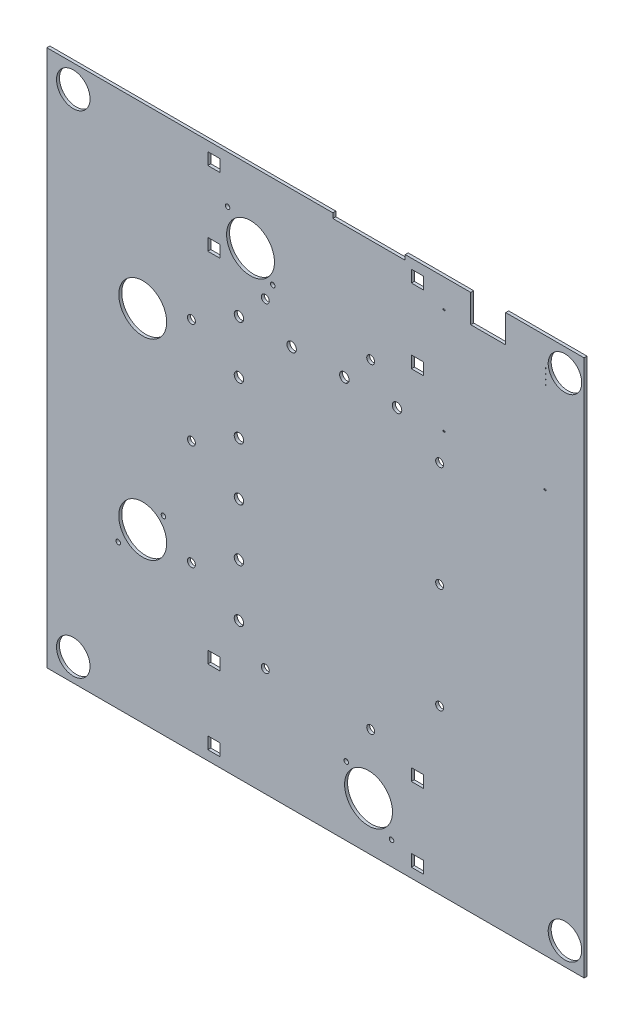
from build123d import *

# Parameters (mm, degrees)
SKETCH3_W           = 1.142982335
SKETCH3_H           = 0.634990186
SKETCH3_R           = 8.889862612
SKETCH3_W_2         = 6.35
SKETCH3_H_2         = 6.35
SKETCH3_R_2         = 2.1
SKETCH3_R_3         = 1.1994003
SKETCH3_R_4         = 12.7
SKETCH3_W_3         = 15.29976355
SKETCH3_H_3         = 7.434865471
SKETCH3_R_5         = 0.229996446
SKETCH3_W_4         = 0.888986261
SKETCH3_W_5         = 15.299763551
SKETCH3_H_4         = 0.634990187
BOSS_EXTRUDE1_DEPTH = 1.5748


with BuildPart() as part:
    # Sketch3 → Boss-Extrude1 (new body)
    # profile 1 of 16: a face of its own
    with BuildSketch(Plane.XY):
        with BuildLine():
            Line((-133.885450353, -29.177459631), (-133.885450353, -14.33744427))
            Line((-133.885450353, -14.33744427), (-148.619709887, -14.33744427))
            ThreePointArc((-148.619709887, -14.33744427), (-148.713001643, -14.959958142), (-148.744201092, -15.588650011))
            Line((-148.744201092, -15.588650011), (-148.744201092, -82.897609788))
            ThreePointArc((-148.744201092, -82.897609788), (-148.703232163, -83.916882208), (-148.580589702, -84.929578385))
            Line((-148.580589702, -84.929578385), (-147.474220719, -84.929578385))
            Line((-147.474220719, -84.929578385), (-147.474220719, -85.564568572))
            Line((-147.474220719, -85.564568572), (-148.461013069, -85.564568572))
            ThreePointArc((-148.461013069, -85.564568572), (-144.02610024, -92.77573886), (-136.04439736, -95.597413519))
            Line((-136.04439736, -95.597413519), (-106.834848778, -95.597413519))
            ThreePointArc((-106.834848778, -95.597413519), (-98.853145899, -92.77573886), (-94.418233069, -85.564568572))
            Line((-94.418233069, -85.564568572), (-95.024031308, -85.564568572))
            Line((-95.024031308, -85.564568572), (-95.024031308, -84.929578385))
            Line((-95.024031308, -84.929578385), (-94.298656436, -84.929578385))
            ThreePointArc((-94.298656436, -84.929578385), (-94.176013976, -83.916882208), (-94.135045047, -82.897609788))
            Line((-94.135045047, -82.897609788), (-94.135045047, -37.305314392))
            Line((-94.135045047, -37.305314392), (-95.024031308, -37.305314392))
            Line((-95.024031308, -37.305314392), (-95.024031308, -36.670324206))
            Line((-95.024031308, -36.670324206), (-94.135045047, -36.670324206))
            Line((-94.135045047, -36.670324206), (-94.135045047, -34.765353646))
            Line((-94.135045047, -34.765353646), (-95.024031308, -34.765353646))
            Line((-95.024031308, -34.765353646), (-95.024031308, -34.130363459))
            Line((-95.024031308, -34.130363459), (-94.135045047, -34.130363459))
            Line((-94.135045047, -34.130363459), (-94.135045047, -32.2253929))
            Line((-94.135045047, -32.2253929), (-95.024031308, -32.2253929))
            Line((-95.024031308, -32.2253929), (-95.024031308, -31.590402713))
            Line((-95.024031308, -31.590402713), (-94.135045047, -31.590402713))
            Line((-94.135045047, -31.590402713), (-94.135045047, -29.685432153))
            Line((-94.135045047, -29.685432153), (-95.024031308, -29.685432153))
            Line((-95.024031308, -29.685432153), (-95.024031308, -29.050441967))
            Line((-95.024031308, -29.050441967), (-94.135045047, -29.050441967))
            Line((-94.135045047, -29.050441967), (-94.135045047, -15.588650011))
            ThreePointArc((-94.135045047, -15.588650011), (-94.166244495, -14.959958142), (-94.259536251, -14.33744427))
            Line((-94.259536251, -14.33744427), (-115.343697651, -14.33744427))
            Line((-115.343697651, -14.33744427), (-115.343697651, -29.177459631))
            Line((-115.343697651, -29.177459631), (-133.885450353, -29.177459631))
        make_face()
        with Locations((-148.045711887, -29.36793706)):
            Rectangle(SKETCH3_W, SKETCH3_H, mode=Mode.SUBTRACT)
    # profile 2 of 16: a face of its own
    with BuildSketch(Plane.XY):
        with BuildLine():
            ThreePointArc((-148.744201092, -15.588650011), (-148.713001643, -14.959958142), (-148.619709887, -14.33744427))
            Line((-148.619709887, -14.33744427), (-168.623873299, -14.33744427))
            Line((-168.623873299, -14.33744427), (-168.623873299, -16.963648389))
            Line((-168.623873299, -16.963648389), (-169.893873299, -16.963648389))
            Line((-169.893873299, -16.963648389), (-169.893873299, -24.39851386))
            Line((-169.893873299, -24.39851386), (-185.193636849, -24.39851386))
            Line((-185.193636849, -24.39851386), (-185.193636849, -16.963648389))
            Line((-185.193636849, -16.963648389), (-190.419987148, -16.963648389))
            Line((-190.419987148, -16.963648389), (-190.419987148, -24.39851386))
            Line((-190.419987148, -24.39851386), (-205.719750699, -24.39851386))
            Line((-205.719750699, -24.39851386), (-205.719750699, -16.963648389))
            Line((-205.719750699, -16.963648389), (-206.989750699, -16.963648389))
            Line((-206.989750699, -16.963648389), (-206.989750699, -14.33744427))
            Line((-206.989750699, -14.33744427), (-358.611033577, -14.33744427))
            Line((-358.611033577, -14.33744427), (-358.611033577, -299.127526398))
            Line((-358.611033577, -299.127526398), (-73.782321777, -299.127526398))
            Line((-73.782321777, -299.127526398), (-73.782321777, -14.33744427))
            Line((-73.782321777, -14.33744427), (-94.259536251, -14.33744427))
            ThreePointArc((-94.259536251, -14.33744427), (-94.166244495, -14.959958142), (-94.135045047, -15.588650011))
            Line((-94.135045047, -15.588650011), (-94.135045047, -29.050441967))
            Line((-94.135045047, -29.050441967), (-93.881048972, -29.050441967))
            Line((-93.881048972, -29.050441967), (-93.881048972, -29.685432153))
            Line((-93.881048972, -29.685432153), (-94.135045047, -29.685432153))
            Line((-94.135045047, -29.685432153), (-94.135045047, -31.590402713))
            Line((-94.135045047, -31.590402713), (-93.881048972, -31.590402713))
            Line((-93.881048972, -31.590402713), (-93.881048972, -32.2253929))
            Line((-93.881048972, -32.2253929), (-94.135045047, -32.2253929))
            Line((-94.135045047, -32.2253929), (-94.135045047, -34.130363459))
            Line((-94.135045047, -34.130363459), (-93.881048972, -34.130363459))
            Line((-93.881048972, -34.130363459), (-93.881048972, -34.765353646))
            Line((-93.881048972, -34.765353646), (-94.135045047, -34.765353646))
            Line((-94.135045047, -34.765353646), (-94.135045047, -36.670324206))
            Line((-94.135045047, -36.670324206), (-93.881048972, -36.670324206))
            Line((-93.881048972, -36.670324206), (-93.881048972, -37.305314392))
            Line((-93.881048972, -37.305314392), (-94.135045047, -37.305314392))
            Line((-94.135045047, -37.305314392), (-94.135045047, -82.897609788))
            ThreePointArc((-94.135045047, -82.897609788), (-94.176013976, -83.916882208), (-94.298656436, -84.929578385))
            Line((-94.298656436, -84.929578385), (-93.881048972, -84.929578385))
            Line((-93.881048972, -84.929578385), (-93.881048972, -85.564568572))
            Line((-93.881048972, -85.564568572), (-94.418233069, -85.564568572))
            ThreePointArc((-94.418233069, -85.564568572), (-98.853145899, -92.77573886), (-106.834848778, -95.597413519))
            Line((-106.834848778, -95.597413519), (-136.04439736, -95.597413519))
            ThreePointArc((-136.04439736, -95.597413519), (-144.02610024, -92.77573886), (-148.461013069, -85.564568572))
            Line((-148.461013069, -85.564568572), (-148.617203054, -85.564568572))
            Line((-148.617203054, -85.564568572), (-148.617203054, -84.929578385))
            Line((-148.617203054, -84.929578385), (-148.580589702, -84.929578385))
            ThreePointArc((-148.580589702, -84.929578385), (-148.703232163, -83.916882208), (-148.744201092, -82.897609788))
            Line((-148.744201092, -82.897609788), (-148.744201092, -15.588650011))
        make_face()
        with Locations((-344.639103912, -287.023912366)):
            Circle(SKETCH3_R, mode=Mode.SUBTRACT)
        with Locations((-270.124321777, -290.872526398)):
            Rectangle(SKETCH3_W_2, SKETCH3_H_2, mode=Mode.SUBTRACT)
        with Locations((-270.124321777, -251.502526398)):
            Rectangle(SKETCH3_W_2, SKETCH3_H_2, mode=Mode.SUBTRACT)
        with BuildLine():
            add(Edge.make_bspline(
                [(-256.85999724, -224.021638864), (-257.021406013, -224.024309852), (-257.382414589, -224.074215165), (-257.916655919, -224.260511889), (-258.393325401, -224.57565247), (-258.766949849, -224.95828446), (-259.037170306, -225.381045042), (-259.221024648, -225.847743239), (-259.306051527, -226.342510426), (-259.294349108, -226.844398246), (-259.180495231, -227.333693057), (-258.974693819, -227.791790332), (-258.679822326, -228.198319036), (-258.312526177, -228.540315274), (-257.883336296, -228.800297414), (-257.412415908, -228.972873885), (-256.91538887, -229.046087349), (-256.412950397, -229.022203622), (-255.925717826, -228.895990433), (-255.472661348, -228.678654156), (-255.073828625, -228.37389952), (-254.741211158, -227.998393935), (-254.491989175, -227.562985092), (-254.331137625, -227.087999747), (-254.270318799, -226.589969862), (-254.306336953, -226.08964653), (-254.443616789, -225.606722239), (-254.671216109, -225.1592348), (-254.985454685, -224.767232517), (-255.369144621, -224.443332536), (-255.810102944, -224.204036936), (-256.20100592, -224.083682076), (-256.509196877, -224.033782598), (-256.699570041, -224.022858517), (-256.815641836, -224.020904872), (-256.85999724, -224.021638864)],
                knots=[0, 0, 0, 0, 0.030814505, 0.069019597, 0.107055287, 0.13877011, 0.17045323, 0.202182021, 0.233877764, 0.265639407, 0.297365916, 0.329128555, 0.360857163, 0.392586882, 0.424283508, 0.45600014, 0.487681866, 0.519541267, 0.551365692, 0.583108167, 0.614814611, 0.646536051, 0.678220231, 0.709938745, 0.741618915, 0.773352224, 0.805046826, 0.836812076, 0.868540761, 0.900300889, 0.93202604, 0.963646014, 0.977849544, 0.991532122, 1, 1, 1, 1], degree=3))
        make_face(mode=Mode.SUBTRACT)
        with Locations((-242.821182519, -241.57744427)):
            Circle(SKETCH3_R_2, mode=Mode.SUBTRACT)
        with Locations((-320.804539148, -222.421426972)):
            Circle(SKETCH3_R_3, mode=Mode.SUBTRACT)
        with Locations((-307.811033577, -210.227526398)):
            Circle(SKETCH3_R_4, mode=Mode.SUBTRACT)
        with Locations((-296.816528582, -198.431137058)):
            Circle(SKETCH3_R_3, mode=Mode.SUBTRACT)
        with Locations((-282.001182519, -212.55744427)):
            Circle(SKETCH3_R_2, mode=Mode.SUBTRACT)
        with BuildLine():
            add(Edge.make_bspline(
                [(-256.85999724, -196.081638864), (-257.021406013, -196.084309852), (-257.382414589, -196.134215165), (-257.916655919, -196.320511889), (-258.393325401, -196.63565247), (-258.766949849, -197.01828446), (-259.037170306, -197.441045042), (-259.221024648, -197.907743239), (-259.306051527, -198.402510426), (-259.294349108, -198.904398246), (-259.180495231, -199.393693057), (-258.974693819, -199.851790332), (-258.679822326, -200.258319036), (-258.312526177, -200.600315274), (-257.883336296, -200.860297414), (-257.412415908, -201.032873885), (-256.91538887, -201.106087349), (-256.412950397, -201.082203622), (-255.925717826, -200.955990433), (-255.472661348, -200.738654156), (-255.073828625, -200.43389952), (-254.741211158, -200.058393935), (-254.491989175, -199.622985092), (-254.331137625, -199.147999747), (-254.270318799, -198.649969862), (-254.306336953, -198.14964653), (-254.443616789, -197.666722239), (-254.671216109, -197.2192348), (-254.985454685, -196.827232517), (-255.369144621, -196.503332536), (-255.810102944, -196.264036936), (-256.20100592, -196.143682076), (-256.509196877, -196.093782598), (-256.699570041, -196.082858517), (-256.815641836, -196.080904872), (-256.85999724, -196.081638864)],
                knots=[0, 0, 0, 0, 0.030814505, 0.069019597, 0.107055287, 0.13877011, 0.17045323, 0.202182021, 0.233877764, 0.265639407, 0.297365916, 0.329128555, 0.360857163, 0.392586882, 0.424283508, 0.45600014, 0.487681866, 0.519541267, 0.551365692, 0.583108167, 0.614814611, 0.646536051, 0.678220231, 0.709938745, 0.741618915, 0.773352224, 0.805046826, 0.836812076, 0.868540761, 0.900300889, 0.93202604, 0.963646014, 0.977849544, 0.991532122, 1, 1, 1, 1], degree=3))
        make_face(mode=Mode.SUBTRACT)
        with Locations((-282.001182519, -156.67744427)):
            Circle(SKETCH3_R_2, mode=Mode.SUBTRACT)
        with BuildLine():
            add(Edge.make_bspline(
                [(-256.85999724, -168.141638864), (-257.021406013, -168.144309852), (-257.382414589, -168.194215165), (-257.916655919, -168.380511889), (-258.393325401, -168.69565247), (-258.766949849, -169.07828446), (-259.037170306, -169.501045042), (-259.221024648, -169.967743239), (-259.306051527, -170.462510426), (-259.294349108, -170.964398246), (-259.180495231, -171.453693057), (-258.974693819, -171.911790332), (-258.679822326, -172.318319036), (-258.312526177, -172.660315274), (-257.883336296, -172.920297414), (-257.412415907, -173.092873888), (-256.915388874, -173.166087339), (-256.412950373, -173.14220366), (-255.925717286, -173.015990136), (-255.472660508, -172.798654333), (-255.073827799, -172.493897777), (-254.741211427, -172.118392321), (-254.491988527, -171.682984122), (-254.331137697, -171.207999706), (-254.27031878, -170.709969873), (-254.306336958, -170.209646527), (-254.443616788, -169.726722239), (-254.671216109, -169.2792348), (-254.985454686, -168.887232516), (-255.369144622, -168.563332534), (-255.810102946, -168.324036936), (-256.201005919, -168.203682076), (-256.509196877, -168.153782598), (-256.699570041, -168.142858517), (-256.815641836, -168.140904872), (-256.85999724, -168.141638864)],
                knots=[0, 0, 0, 0, 0.030814505, 0.069019599, 0.107055288, 0.138770112, 0.170453233, 0.202182024, 0.233877768, 0.265639411, 0.29736592, 0.32912856, 0.360857169, 0.392586888, 0.424283514, 0.456000147, 0.487681873, 0.519541275, 0.5513657, 0.583108297, 0.614814617, 0.646536271, 0.678220227, 0.709938741, 0.741618911, 0.773352221, 0.805046823, 0.836812073, 0.868540759, 0.900300887, 0.932026039, 0.963646013, 0.977849544, 0.991532122, 1, 1, 1, 1], degree=3))
        make_face(mode=Mode.SUBTRACT)
        with Locations((-199.878713211, -262.73302365)):
            Circle(SKETCH3_R_3, mode=Mode.SUBTRACT)
        with Locations((-188.082321777, -273.727526398)):
            Circle(SKETCH3_R_4, mode=Mode.SUBTRACT)
        with Locations((-175.888418729, -286.721029647)):
            Circle(SKETCH3_R_3, mode=Mode.SUBTRACT)
        with Locations((-162.174321777, -290.872526398)):
            Rectangle(SKETCH3_W_2, SKETCH3_H_2, mode=Mode.SUBTRACT)
        with Locations((-186.941182519, -241.57744427)):
            Circle(SKETCH3_R_2, mode=Mode.SUBTRACT)
        with Locations((-162.174321777, -251.502526398)):
            Rectangle(SKETCH3_W_2, SKETCH3_H_2, mode=Mode.SUBTRACT)
        with Locations((-83.917293159, -287.023912366)):
            Circle(SKETCH3_R, mode=Mode.SUBTRACT)
        with Locations((-150.399321777, -212.55744427)):
            Circle(SKETCH3_R_2, mode=Mode.SUBTRACT)
        with BuildLine():
            ThreePointArc((-151.618840591, -154.967832073), (-149.437809819, -154.810496291), (-148.299321777, -156.67744427))
            ThreePointArc((-148.299321777, -156.67744427), (-151.360833735, -158.544392248), (-151.618840591, -154.967832073))
        make_face(mode=Mode.SUBTRACT)
        with Locations((-307.811033577, -108.627526398)):
            Circle(SKETCH3_R_4, mode=Mode.SUBTRACT)
        with BuildLine():
            add(Edge.make_bspline(
                [(-256.85999724, -140.201638864), (-257.021406165, -140.204309847), (-257.382415009, -140.254215108), (-257.916656107, -140.440512414), (-258.393325613, -140.755652577), (-258.766949839, -141.138284477), (-259.037170308, -141.561045037), (-259.22102465, -142.027743242), (-259.306051516, -142.52251042), (-259.294349148, -143.024398267), (-259.18049493, -143.513693632), (-258.974694037, -143.971791212), (-258.679821182, -144.378320018), (-258.312525009, -144.720315059), (-257.883336553, -144.980297614), (-257.412416575, -145.152872668), (-256.91539018, -145.226086503), (-256.412950715, -145.20220401), (-255.925718176, -145.075990507), (-255.472661345, -144.85865418), (-255.073828626, -144.553899514), (-254.741211157, -144.178393936), (-254.491989175, -143.742985092), (-254.331137625, -143.267999747), (-254.270318799, -142.769969862), (-254.306336953, -142.26964653), (-254.443616789, -141.786722239), (-254.671216109, -141.3392348), (-254.985454685, -140.947232517), (-255.369144621, -140.623332536), (-255.810102944, -140.384036936), (-256.20100592, -140.263682076), (-256.509196877, -140.213782599), (-256.699570042, -140.202858515), (-256.815641836, -140.200904874), (-256.85999724, -140.201638864)],
                knots=[0, 0, 0, 0, 0.030814534, 0.069019644, 0.107055287, 0.138770111, 0.170453232, 0.202182023, 0.233877767, 0.265639411, 0.29736592, 0.329128687, 0.360857171, 0.392587044, 0.424283511, 0.455999957, 0.487681857, 0.519541184, 0.551365681, 0.583108157, 0.614814601, 0.646536043, 0.678220224, 0.709938738, 0.741618909, 0.773352218, 0.805046821, 0.836812072, 0.868540758, 0.900300886, 0.932026039, 0.963646013, 0.977849544, 0.991532122, 1, 1, 1, 1], degree=3))
        make_face(mode=Mode.SUBTRACT)
        with Locations((-282.001182519, -100.79744427)):
            Circle(SKETCH3_R_2, mode=Mode.SUBTRACT)
        with BuildLine():
            add(Edge.make_bspline(
                [(-256.85999724, -112.261638864), (-257.021406013, -112.264309852), (-257.382414589, -112.314215165), (-257.916655919, -112.500511889), (-258.393325401, -112.81565247), (-258.766949849, -113.19828446), (-259.037170306, -113.621045042), (-259.221024648, -114.087743239), (-259.306051527, -114.582510426), (-259.294349108, -115.084398246), (-259.180495232, -115.573693059), (-258.974693815, -116.031790325), (-258.679822368, -116.438319024), (-258.312526163, -116.780315146), (-257.883337234, -117.040297063), (-257.412416597, -117.212872714), (-256.915390174, -117.286086475), (-256.412950684, -117.262204075), (-255.925717281, -117.135990012), (-255.472659952, -116.918654478), (-255.073827277, -116.613897745), (-254.741211725, -116.238392122), (-254.491988674, -115.802984185), (-254.331137623, -115.327999811), (-254.270318791, -114.829969958), (-254.306336977, -114.329646533), (-254.443616757, -113.846722296), (-254.671216111, -113.39923488), (-254.985454601, -113.007232606), (-255.369144544, -112.68333252), (-255.810102899, -112.444036966), (-256.201005919, -112.323682075), (-256.509196878, -112.273782599), (-256.699570041, -112.262858517), (-256.815641836, -112.260904872), (-256.85999724, -112.261638864)],
                knots=[0, 0, 0, 0, 0.030814506, 0.0690196, 0.10705529, 0.138770114, 0.170453236, 0.202182027, 0.233877771, 0.265639415, 0.297365925, 0.329128565, 0.360857174, 0.392586885, 0.424283519, 0.455999966, 0.487681866, 0.519541192, 0.55136569, 0.583108366, 0.614814614, 0.646536265, 0.678220222, 0.709938719, 0.741618907, 0.773352217, 0.80504682, 0.836812058, 0.868540757, 0.900300875, 0.932026038, 0.963646013, 0.977849544, 0.991532122, 1, 1, 1, 1], degree=3))
        make_face(mode=Mode.SUBTRACT)
        with BuildLine():
            add(Edge.make_bspline(
                [(-256.85999724, -84.321638864), (-257.021406013, -84.324309852), (-257.382414591, -84.374215163), (-257.916655909, -84.560511898), (-258.39332531, -84.875652355), (-258.766949645, -85.258284434), (-259.037170146, -85.681044833), (-259.221024721, -86.147743103), (-259.306051502, -86.642510319), (-259.294349116, -87.144398244), (-259.180495229, -87.633693058), (-258.97469382, -88.091790332), (-258.679822326, -88.498319036), (-258.312526177, -88.840315274), (-257.883336296, -89.100297414), (-257.412415908, -89.272873885), (-256.91538887, -89.346087349), (-256.412950397, -89.322203622), (-255.925717826, -89.195990433), (-255.472661348, -88.978654156), (-255.073828625, -88.67389952), (-254.741211158, -88.298393935), (-254.491989175, -87.862985092), (-254.331137625, -87.387999747), (-254.270318799, -86.889969862), (-254.306336953, -86.38964653), (-254.443616789, -85.906722239), (-254.671216109, -85.4592348), (-254.985454686, -85.067232516), (-255.369144622, -84.743332534), (-255.810102946, -84.504036936), (-256.201005919, -84.383682076), (-256.509196877, -84.333782598), (-256.699570041, -84.322858517), (-256.815641836, -84.320904872), (-256.85999724, -84.321638864)],
                knots=[0, 0, 0, 0, 0.030814505, 0.069019598, 0.107055287, 0.138770082, 0.170453229, 0.202181999, 0.233877763, 0.265639406, 0.297365915, 0.329128555, 0.360857163, 0.392586882, 0.424283507, 0.456000139, 0.487681865, 0.519541266, 0.551365691, 0.583108167, 0.61481461, 0.646536051, 0.678220231, 0.709938745, 0.741618915, 0.773352224, 0.805046826, 0.836812076, 0.868540761, 0.900300889, 0.93202604, 0.963646014, 0.977849544, 0.991532122, 1, 1, 1, 1], degree=3))
        make_face(mode=Mode.SUBTRACT)
        with BuildLine():
            add(Edge.make_bspline(
                [(-228.782367797, -89.333249675), (-228.620959024, -89.330578687), (-228.259950448, -89.280673374), (-227.725709118, -89.09437665), (-227.249039636, -88.779236069), (-226.875415188, -88.396604079), (-226.605194732, -87.973843498), (-226.421340386, -87.507145298), (-226.336313523, -87.012378119), (-226.348015882, -86.51049027), (-226.461870157, -86.021194817), (-226.667670964, -85.563097177), (-226.962543497, -85.156568341), (-227.329839723, -84.814573359), (-227.759029245, -84.554590778), (-228.229949155, -84.382014684), (-228.726976152, -84.308801197), (-229.229414675, -84.332684858), (-229.716648105, -84.458898599), (-230.169705082, -84.676234086), (-230.56853776, -84.980990788), (-230.901153312, -85.356496419), (-231.15037636, -85.791904341), (-231.3112274, -86.266888718), (-231.372046243, -86.764918567), (-231.336028082, -87.265242009), (-231.198748276, -87.748166252), (-230.971148913, -88.195653662), (-230.65691043, -88.587655942), (-230.273220493, -88.911556019), (-229.832262138, -89.150851573), (-229.441359118, -89.271206464), (-229.13316816, -89.321105941), (-228.942794996, -89.332030022), (-228.826723201, -89.333983667), (-228.782367797, -89.333249675)],
                knots=[0, 0, 0, 0, 0.030814505, 0.069019598, 0.107055287, 0.138770111, 0.170453232, 0.202182022, 0.233877766, 0.265639409, 0.297365918, 0.329128704, 0.360857174, 0.392587009, 0.424283515, 0.456000147, 0.487681873, 0.519541275, 0.5513657, 0.583108375, 0.614814623, 0.646536273, 0.678220229, 0.709938723, 0.741618913, 0.773352222, 0.805046825, 0.836812064, 0.86854076, 0.900300877, 0.93202604, 0.963646014, 0.977849544, 0.991532122, 1, 1, 1, 1], degree=3))
        make_face(mode=Mode.SUBTRACT)
        with Locations((-344.639103912, -26.441058302)):
            Circle(SKETCH3_R, mode=Mode.SUBTRACT)
        with Locations((-270.124321777, -61.96244427)):
            Rectangle(SKETCH3_W_2, SKETCH3_H_2, mode=Mode.SUBTRACT)
        with Locations((-242.821182519, -71.77744427)):
            Circle(SKETCH3_R_2, mode=Mode.SUBTRACT)
        with Locations((-238.864644237, -63.431949265)):
            Circle(SKETCH3_R_3, mode=Mode.SUBTRACT)
        with Locations((-250.661033577, -52.43744427)):
            Circle(SKETCH3_R_4, mode=Mode.SUBTRACT)
        with Locations((-262.854934151, -39.443938699)):
            Circle(SKETCH3_R_3, mode=Mode.SUBTRACT)
        with Locations((-270.124321777, -22.59244427)):
            Rectangle(SKETCH3_W_2, SKETCH3_H_2, mode=Mode.SUBTRACT)
        with BuildLine():
            add(Edge.make_bspline(
                [(-200.97999724, -84.321638864), (-201.141406012, -84.324309854), (-201.502414778, -84.374215221), (-202.036656161, -84.560511852), (-202.51332574, -84.875652615), (-202.886949828, -85.258284675), (-203.157170395, -85.681045162), (-203.341024639, -86.147743246), (-203.426051529, -86.642510424), (-203.414349107, -87.144398247), (-203.300495231, -87.633693057), (-203.094693819, -88.091790332), (-202.799822326, -88.498319036), (-202.432526177, -88.840315274), (-202.003336296, -89.100297414), (-201.532415907, -89.272873888), (-201.035388876, -89.34608734), (-200.532950376, -89.322203658), (-200.045717288, -89.19599014), (-199.592660519, -88.978654327), (-199.193827923, -88.673897936), (-198.861211703, -88.298392369), (-198.611988767, -87.862984333), (-198.451137613, -87.387999818), (-198.390318795, -86.889969946), (-198.426336964, -86.389646519), (-198.563616792, -85.906722228), (-198.79121611, -85.4592348), (-199.105454684, -85.067232517), (-199.489144622, -84.743332536), (-199.930102944, -84.504036936), (-200.32100592, -84.383682077), (-200.629196877, -84.333782598), (-200.819570041, -84.322858517), (-200.935641837, -84.320904872), (-200.97999724, -84.321638864)],
                knots=[0, 0, 0, 0, 0.030814505, 0.069019637, 0.107055291, 0.138770143, 0.170453235, 0.202182026, 0.233877769, 0.265639413, 0.297365922, 0.329128562, 0.360857171, 0.39258689, 0.424283516, 0.456000149, 0.487681875, 0.519541277, 0.551365702, 0.583108299, 0.614814619, 0.646536235, 0.678220226, 0.709938723, 0.741618911, 0.773352222, 0.805046823, 0.836812073, 0.868540759, 0.900300887, 0.932026039, 0.963646013, 0.977849544, 0.991532122, 1, 1, 1, 1], degree=3))
        make_face(mode=Mode.SUBTRACT)
        with Locations((-150.399321777, -100.79744427)):
            Circle(SKETCH3_R_2, mode=Mode.SUBTRACT)
        with BuildLine():
            add(Edge.make_bspline(
                [(-172.902367797, -89.333249675), (-172.740959024, -89.330578687), (-172.379950448, -89.280673374), (-171.845709118, -89.09437665), (-171.369039636, -88.779236069), (-170.995415189, -88.396604079), (-170.725194731, -87.973843498), (-170.541340389, -87.5071453), (-170.45631351, -87.012378113), (-170.468015929, -86.510490293), (-170.581869807, -86.021195482), (-170.787671218, -85.563098207), (-171.082542711, -85.156569503), (-171.44983886, -84.814573265), (-171.879028741, -84.554591125), (-172.349949129, -84.382014654), (-172.846976167, -84.30880119), (-173.34941464, -84.332684917), (-173.836647211, -84.458898106), (-174.289703689, -84.676234383), (-174.688536412, -84.980989019), (-175.02115388, -85.356494604), (-175.270375862, -85.791903447), (-175.431227412, -86.266888792), (-175.492046238, -86.764918677), (-175.456028084, -87.265242009), (-175.318748248, -87.7481663), (-175.091148928, -88.195653739), (-174.776910353, -88.587656022), (-174.393220416, -88.911556003), (-173.952262093, -89.150851603), (-173.561359118, -89.271206463), (-173.25316816, -89.321105941), (-173.062794996, -89.332030022), (-172.946723201, -89.333983667), (-172.902367797, -89.333249675)],
                knots=[0, 0, 0, 0, 0.030814505, 0.069019597, 0.107055287, 0.13877011, 0.17045323, 0.202182021, 0.233877764, 0.265639407, 0.297365916, 0.329128555, 0.360857163, 0.392586882, 0.424283508, 0.45600014, 0.487681866, 0.519541267, 0.551365692, 0.583108167, 0.614814611, 0.646536051, 0.678220231, 0.709938745, 0.741618915, 0.773352224, 0.805046826, 0.836812076, 0.868540761, 0.900300889, 0.93202604, 0.963646014, 0.977849544, 0.991532122, 1, 1, 1, 1], degree=3))
        make_face(mode=Mode.SUBTRACT)
        with Locations((-186.941182519, -71.77744427)):
            Circle(SKETCH3_R_2, mode=Mode.SUBTRACT)
        with Locations((-162.174321777, -61.96244427)):
            Rectangle(SKETCH3_W_2, SKETCH3_H_2, mode=Mode.SUBTRACT)
        with Locations((-162.174321777, -22.59244427)):
            Rectangle(SKETCH3_W_2, SKETCH3_H_2, mode=Mode.SUBTRACT)
        with Locations((-83.917293159, -26.441058302)):
            Circle(SKETCH3_R, mode=Mode.SUBTRACT)
    # profile 3 of 16: a face of its own
    with BuildSketch(Plane.XY):
        with Locations((-177.543755074, -20.681081125)):
            Rectangle(SKETCH3_W_3, SKETCH3_H_3)
        with Locations((-181.98868638, -23.20853225)):
            Circle(SKETCH3_R_5, mode=Mode.SUBTRACT)
        with Locations((-180.718706007, -20.668571504)):
            Circle(SKETCH3_R_5, mode=Mode.SUBTRACT)
        with BuildLine():
            add(Edge.make_bspline(
                [(-179.678722079, -23.20853225), (-179.678722079, -23.668525141), (-179.218729188, -23.668525141), (-179.218729188, -23.20853225), (-179.218729188, -22.748539359), (-179.678722079, -22.748539359), (-179.678722079, -23.20853225)],
                knots=[0, 0, 0, 0, 0.5, 0.5, 0.5, 1, 1, 1, 1], degree=3, weights=[1, 0.333333333, 0.333333333, 1, 0.333333333, 0.333333333, 1]))
        make_face(mode=Mode.SUBTRACT)
        with Locations((-176.908764888, -23.20853225)):
            Circle(SKETCH3_R_5, mode=Mode.SUBTRACT)
        with Locations((-178.178745261, -20.668571504)):
            Circle(SKETCH3_R_5, mode=Mode.SUBTRACT)
        with Locations((-174.368804141, -23.20853225)):
            Circle(SKETCH3_R_5, mode=Mode.SUBTRACT)
        with Locations((-175.638784514, -20.668571504)):
            Circle(SKETCH3_R_5, mode=Mode.SUBTRACT)
        with Locations((-173.098823768, -20.668571504)):
            Circle(SKETCH3_R_5, mode=Mode.SUBTRACT)
    # profile 4 of 16: a face of its own
    with BuildSketch(Plane.XY):
        with Locations((-94.579538178, -29.36793706)):
            Rectangle(SKETCH3_W_4, SKETCH3_H)
    # profile 5 of 16: a face of its own
    with BuildSketch(Plane.XY):
        with Locations((-198.069868923, -20.681081125)):
            Rectangle(SKETCH3_W_5, SKETCH3_H_3)
    # profile 6 of 16: a face of its own
    with BuildSketch(Plane.XY):
        with Locations((-94.579538178, -31.907897807)):
            Rectangle(SKETCH3_W_4, SKETCH3_H_4)
    # profile 7 of 16: a face of its own
    with BuildSketch(Plane.XY):
        with Locations((-94.579538178, -34.447858553)):
            Rectangle(SKETCH3_W_4, SKETCH3_H_4)
    # profile 8 of 16: a face of its own
    with BuildSketch(Plane.XY):
        with Locations((-94.579538178, -36.987819299)):
            Rectangle(SKETCH3_W_4, SKETCH3_H)
    # profile 9 of 16: a face of its own
    with BuildSketch(Plane.XY):
        with Locations((-181.98868638, -23.20853225)):
            Circle(SKETCH3_R_5)
    # profile 10 of 16: a face of its own
    with BuildSketch(Plane.XY):
        with Locations((-180.718706007, -20.668571504)):
            Circle(SKETCH3_R_5)
    # profile 11 of 16: a face of its own
    with BuildSketch(Plane.XY):
        with Locations((-178.178745261, -20.668571504)):
            Circle(SKETCH3_R_5)
    # profile 12 of 16: a face of its own
    with BuildSketch(Plane.XY):
        with Locations((-175.638784514, -20.668571504)):
            Circle(SKETCH3_R_5)
    # profile 13 of 16: a face of its own
    with BuildSketch(Plane.XY):
        with Locations((-176.908764888, -23.20853225)):
            Circle(SKETCH3_R_5)
    # profile 14 of 16: a face of its own
    with BuildSketch(Plane.XY):
        with Locations((-174.368804141, -23.20853225)):
            Circle(SKETCH3_R_5)
    # profile 15 of 16: a face of its own
    with BuildSketch(Plane.XY):
        with Locations((-173.098823768, -20.668571504)):
            Circle(SKETCH3_R_5)
    # profile 16 of 16: a face of its own
    with BuildSketch(Plane.XY):
        with BuildLine():
            add(Edge.make_bspline(
                [(-179.678722079, -23.20853225), (-179.678722079, -23.668525141), (-179.218729188, -23.668525141), (-179.218729188, -23.20853225), (-179.218729188, -22.748539359), (-179.678722079, -22.748539359), (-179.678722079, -23.20853225)],
                knots=[0, 0, 0, 0, 0.5, 0.5, 0.5, 1, 1, 1, 1], degree=3, weights=[1, 0.333333333, 0.333333333, 1, 0.333333333, 0.333333333, 1]))
        make_face()
    extrude(amount=BOSS_EXTRUDE1_DEPTH)


solid = part.part
